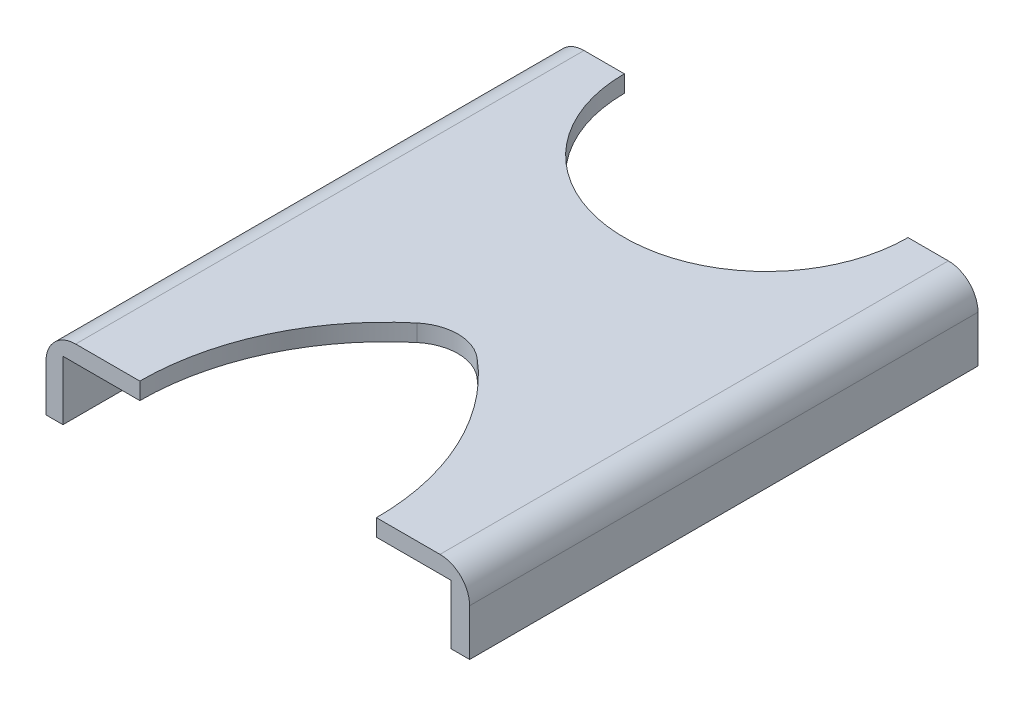
from build123d import *

# Parameters (mm, degrees)
SKETCH1_W           = 1000
SKETCH1_H           = 1200
BOSS_EXTRUDE1_DEPTH = 40
SKETCH2_W           = 44.100266395
SKETCH2_H           = 1200
SKETCH2_W_2         = 40
BOSS_EXTRUDE2_DEPTH = 140
FILLET1_R           = 70
SKETCH3_R           = 334.802588384
CUT_EXTRUDE2_DEPTH  = 140


with BuildPart() as part:
    # Sketch1 → Boss-Extrude1 (new body)
    with BuildSketch(Plane(origin=(0, 0, 0), x_dir=(1, 0, 0), z_dir=(0, 1, 0))):
        with Locations((500, 600)):
            Rectangle(SKETCH1_W, SKETCH1_H)
    extrude(amount=BOSS_EXTRUDE1_DEPTH)

    # Sketch2 → Boss-Extrude2 (add)
    with BuildSketch(Plane.XZ):
        with Locations((977.949866803, -600)):
            Rectangle(SKETCH2_W, SKETCH2_H)
        with Locations((20, -600)):
            Rectangle(SKETCH2_W_2, SKETCH2_H)
    extrude(amount=BOSS_EXTRUDE2_DEPTH)

    # Fillet1
    fillet1_edges = [part.edges().sort_by_distance(p)[0] for p in [
        (1000, 40, -600),
        (0, 40, -600),
    ]]
    fillet(fillet1_edges, radius=FILLET1_R)

    # Sketch3 → Cut-Extrude2 (cut)
    with BuildSketch(Plane(origin=(0, 40, 0), x_dir=(1, 0, 0), z_dir=(0, 1, 0))):
        with Locations((500, 1200)):
            Circle(SKETCH3_R)
        with BuildLine():
            Line((221.441080201, 0), (780, 0))
            ThreePointArc((780, 0), (725.321357402, 246.103392604), (571.573934725, 445.899197935))
            ThreePointArc((571.573934725, 445.899197935), (500.7205401, 471.613897531), (429.867145476, 445.899197935))
            ThreePointArc((429.867145476, 445.899197935), (276.119722799, 246.103392604), (221.441080201, 0))
        make_face()
    extrude(amount=-CUT_EXTRUDE2_DEPTH, mode=Mode.SUBTRACT)


solid = part.part
